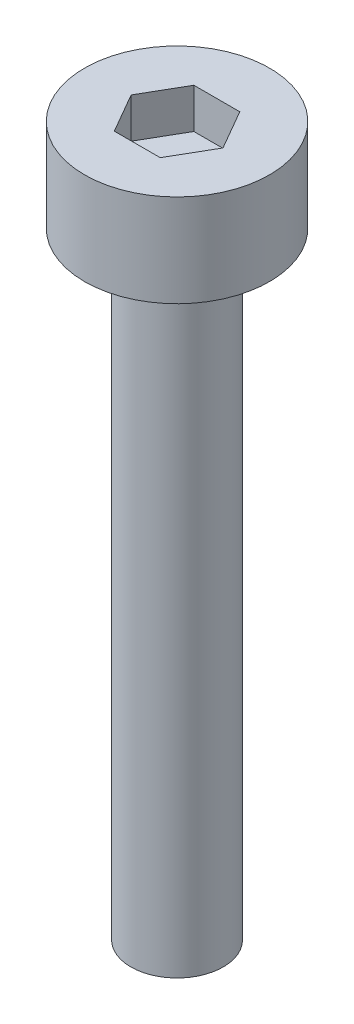
from build123d import *

# Parameters (mm, degrees)
SKETCH1_R           = 1.5
SCREWSHAFT_DEPTH    = 20
SKETCH2_R           = 3
BOSS_EXTRUDE2_DEPTH = 3
CUT_EXTRUDE1_DEPTH  = 1.3


with BuildPart() as part:
    # Sketch1 → ScrewShaft (new body)
    with BuildSketch(Plane(origin=(0, 0, 0), x_dir=(1, 0, 0), z_dir=(0, 1, 0))):
        with Locations(Location((0, 0, 0), (0, 0, 270))):
            Circle(SKETCH1_R)
    extrude(amount=SCREWSHAFT_DEPTH)

    # Sketch2 → Boss-Extrude2 (add)
    with BuildSketch(Plane(origin=(0, 20, 0), x_dir=(1, 0, 0), z_dir=(0, 1, 0))):
        with Locations(Location((0, 0, 0), (0, 0, 270))):
            Circle(SKETCH2_R)
    extrude(amount=BOSS_EXTRUDE2_DEPTH)

    # Sketch3 → Cut-Extrude1 (cut)
    with BuildSketch(Plane(origin=(0, 23, 0), x_dir=(1, 0, 0), z_dir=(0, 1, 0))):
        Polygon((1.489563695, 0), (0.744781847, 1.29), (-0.744781847, 1.29), (-1.489563695, 0), (-0.744781847, -1.29), (0.744781847, -1.29), align=None)
    extrude(amount=-CUT_EXTRUDE1_DEPTH, mode=Mode.SUBTRACT)


solid = part.part
